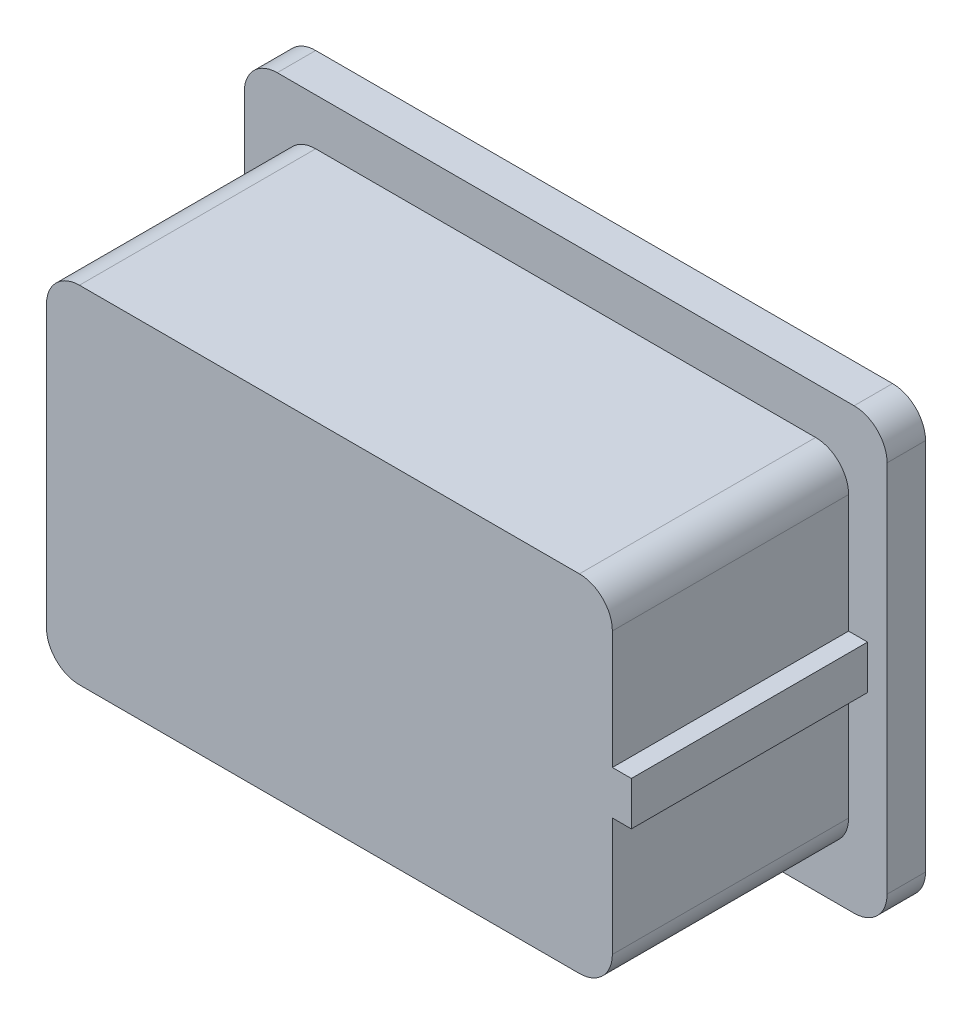
from build123d import *

# Parameters (mm, degrees)
SKETCH_1_W           = 58.5
SKETCH_1_H           = 40
EXTRUDE_1_DEPTH      = 25
SKETCH_2_OUTSIDE_W   = 75.53
SKETCH_2_OUTSIDE_H   = 57.03
SKETCH_2_OUTSIDE_W_2 = 51.5
SKETCH_2_OUTSIDE_H_2 = 31.5
CUT_EXTRUDE_4_DEPTH  = 21.5
EXTRUDE_2_REACH      = 45.365
SKETCH_3_W           = 3.457860742
SKETCH_3_H           = 3.97738732
FILLET_1_R           = 3
FILLET_2_R           = 3
FILLET_3_R           = 3


with BuildPart() as part:
    # 草图1 → 凸台-拉伸1 (new body)
    with BuildSketch(Plane.XY):
        Rectangle(SKETCH_1_W, SKETCH_1_H)
    extrude(amount=EXTRUDE_1_DEPTH)

    # 草图2 outside → 切除-拉伸4 (cut)
    with BuildSketch(Plane.XY.offset(25)):
        Rectangle(SKETCH_2_OUTSIDE_W, SKETCH_2_OUTSIDE_H)
        Rectangle(SKETCH_2_OUTSIDE_W_2, SKETCH_2_OUTSIDE_H_2, mode=Mode.SUBTRACT)
    extrude(amount=-CUT_EXTRUDE_4_DEPTH, mode=Mode.SUBTRACT)

    # 草图3 → 凸台-拉伸2 (add, up to next)
    with BuildSketch(Plane.XY.offset(25), mode=Mode.PRIVATE) as extrude_2_sk1:
        with Locations((25.75, 0)):
            Rectangle(SKETCH_3_W, SKETCH_3_H)
    extrude_2_tool1 = extrude(extrude_2_sk1.sketch, amount=-EXTRUDE_2_REACH, mode=Mode.PRIVATE) - part.part
    add(extrude_2_tool1.solids().sort_by_distance((25.75, 0, 25))[0])

    # 圆角1
    fillet_1_edges = [part.edges().sort_by_distance(p)[0] for p in [
        (25.75, -15.75, 14.25),
        (25.75, 15.75, 14.25),
    ]]
    fillet(fillet_1_edges, radius=FILLET_1_R)

    # 圆角2
    fillet_2_edges = [part.edges().sort_by_distance(p)[0] for p in [
        (-25.75, -15.75, 14.25),
        (-25.75, 15.75, 14.25),
    ]]
    fillet(fillet_2_edges, radius=FILLET_2_R)

    # 圆角3
    fillet_3_edges = [part.edges().sort_by_distance(p)[0] for p in [
        (29.25, -20, 1.75),
        (-29.25, -20, 1.75),
        (-29.25, 20, 1.75),
        (29.25, 20, 1.75),
    ]]
    fillet(fillet_3_edges, radius=FILLET_3_R)


solid = part.part
